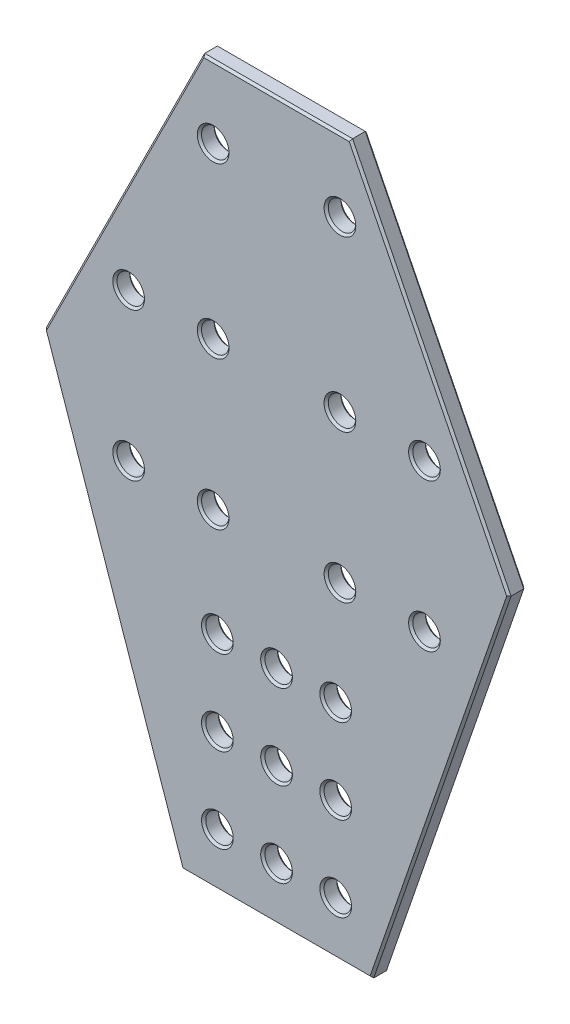
from build123d import *

# Parameters (mm, degrees)
SKETCH_1_R        = 13
EXTRUDE_924_DEPTH = 16
CHAMFER_1_SIZE    = 2


with BuildPart() as part:
    # 草图1 → Extrude 924 (new body)
    with BuildSketch(Plane.XY):
        Polygon((-70, 228), (70, 228), (220, -72), (90, -450), (-90, -450), (-220, -72), align=None)
        with Locations((-140, 0)):
            Circle(SKETCH_1_R, mode=Mode.SUBTRACT)
        with Locations((-60, 0)):
            Circle(SKETCH_1_R, mode=Mode.SUBTRACT)
        with Locations(Location((60, -140, 0), (0, 0, 180))):
            Circle(SKETCH_1_R, mode=Mode.SUBTRACT)
        with Locations(Location((140, -140, 0), (0, 0, 180))):
            Circle(SKETCH_1_R, mode=Mode.SUBTRACT)
        with Locations((-140, -140)):
            Circle(SKETCH_1_R, mode=Mode.SUBTRACT)
        with Locations((-60, -140)):
            Circle(SKETCH_1_R, mode=Mode.SUBTRACT)
        with Locations(Location((60, 0, 0), (0, 0, 180))):
            Circle(SKETCH_1_R, mode=Mode.SUBTRACT)
        with Locations(Location((140, 0, 0), (0, 0, 180))):
            Circle(SKETCH_1_R, mode=Mode.SUBTRACT)
        with Locations((0, -400)):
            Circle(SKETCH_1_R, mode=Mode.SUBTRACT)
        with Locations((0, -240)):
            Circle(SKETCH_1_R, mode=Mode.SUBTRACT)
        with Locations((60, 160)):
            Circle(SKETCH_1_R, mode=Mode.SUBTRACT)
        with Locations((0, -320)):
            Circle(SKETCH_1_R, mode=Mode.SUBTRACT)
        with Locations((-60, 160)):
            Circle(SKETCH_1_R, mode=Mode.SUBTRACT)
        with Locations((56, -240)):
            Circle(SKETCH_1_R, mode=Mode.SUBTRACT)
        with Locations((56, -320)):
            Circle(SKETCH_1_R, mode=Mode.SUBTRACT)
        with Locations((56, -400)):
            Circle(SKETCH_1_R, mode=Mode.SUBTRACT)
        with Locations(Location((-56, -400, 0), (0, 0, 180))):
            Circle(SKETCH_1_R, mode=Mode.SUBTRACT)
        with Locations(Location((-56, -320, 0), (0, 0, 180))):
            Circle(SKETCH_1_R, mode=Mode.SUBTRACT)
        with Locations(Location((-56, -240, 0), (0, 0, 180))):
            Circle(SKETCH_1_R, mode=Mode.SUBTRACT)
    extrude(amount=EXTRUDE_924_DEPTH)

    # 倒角1
    chamfer_1_edges = [part.edges().sort_by_distance(p)[0] for p in [
        (0, -450, 16),
        (155, -261, 16),
        (145, 78, 16),
        (-153, 0, 0),
        (-153, 0, 16),
        (0, 228, 16),
        (-73, 0, 0),
        (-73, 0, 16),
        (73, -140, 0),
        (73, -140, 16),
        (153, -140, 0),
        (153, -140, 16),
        (-153, -140, 0),
        (-153, -140, 16),
        (-73, -140, 0),
        (-73, -140, 16),
        (73, 0, 0),
        (73, 0, 16),
        (-145, 78, 16),
        (153, 0, 0),
        (153, 0, 16),
        (-13, -400, 0),
        (-13, -400, 16),
        (-13, -240, 0),
        (-13, -240, 16),
        (-13, -320, 0),
        (-13, -320, 16),
        (47, 160, 0),
        (47, 160, 16),
        (0, 228, 0),
        (-73, 160, 0),
        (-73, 160, 16),
        (145, 78, 0),
        (43, -240, 0),
        (43, -240, 16),
        (155, -261, 0),
        (43, -320, 0),
        (43, -320, 16),
        (-155, -261, 16),
        (0, -450, 0),
        (43, -400, 0),
        (43, -400, 16),
        (-155, -261, 0),
        (-43, -400, 0),
        (-43, -400, 16),
        (-145, 78, 0),
        (-43, -320, 0),
        (-43, -320, 16),
        (-43, -240, 0),
        (-43, -240, 16),
    ]]
    chamfer(chamfer_1_edges, length=CHAMFER_1_SIZE)


solid = part.part
